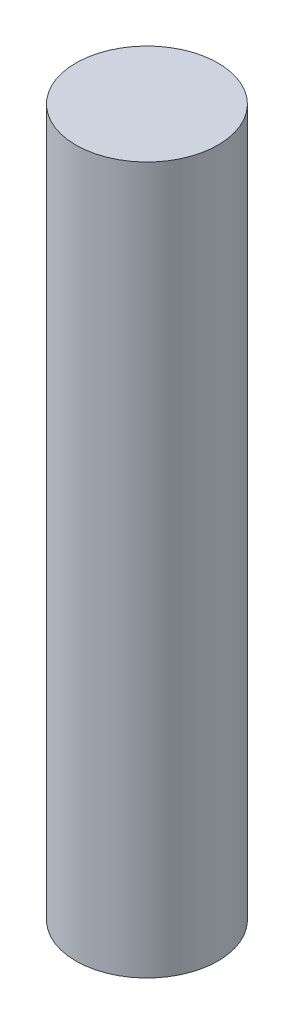
from build123d import *

# Parameters (mm, degrees)
CROQUIS1_R              = 4
SALIENTE_EXTRUIR1_DEPTH = 39.768966


with BuildPart() as part:
    # Croquis1 → Saliente-Extruir1 (new body)
    with BuildSketch(Plane(origin=(0, 0, 0), x_dir=(1, 0, 0), z_dir=(0, 1, 0))):
        with Locations(Location((0, 0, 0), (0, 0, 270))):
            Circle(CROQUIS1_R)
    extrude(amount=SALIENTE_EXTRUIR1_DEPTH)


solid = part.part
